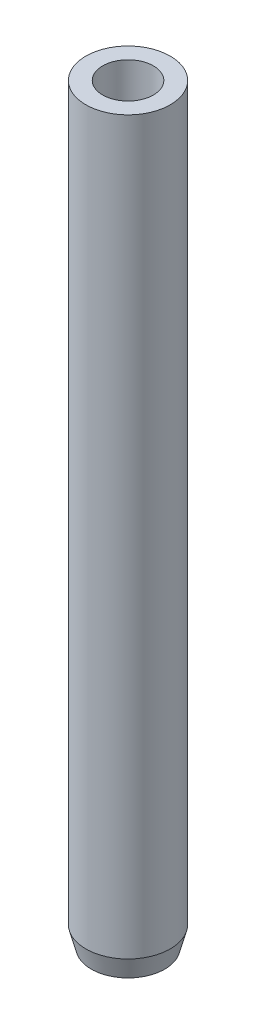
from build123d import *


with BuildPart() as part:
    # Sketch1 → Revolve1 (revolve)
    with BuildSketch(Plane.XY, mode=Mode.PRIVATE) as revolve1_sk:
        with BuildLine():
            Line((0, 0), (0, 38.5))
            Line((0, 38.5), (-1.5, 38.5))
            Line((-1.5, 38.5), (-1.5, 44.5))
            Line((-1.5, 44.5), (-2.5, 44.5))
            Line((-2.5, 44.5), (-2.5, 1.2))
            Line((-2.5, 1.2), (-2.178460969, 0))
            ThreePointArc((-2.178460969, 0), (-1.117552258, -0.373395754), (0, -0.5))
            Line((0, -0.5), (0, 0))
        make_face()
    revolve(revolve1_sk.sketch.rotate(Axis((0, 0, 0), (0, 1, 0)), 270), axis=Axis((0, 0, 0), (0, 1, 0)))


solid = part.part
